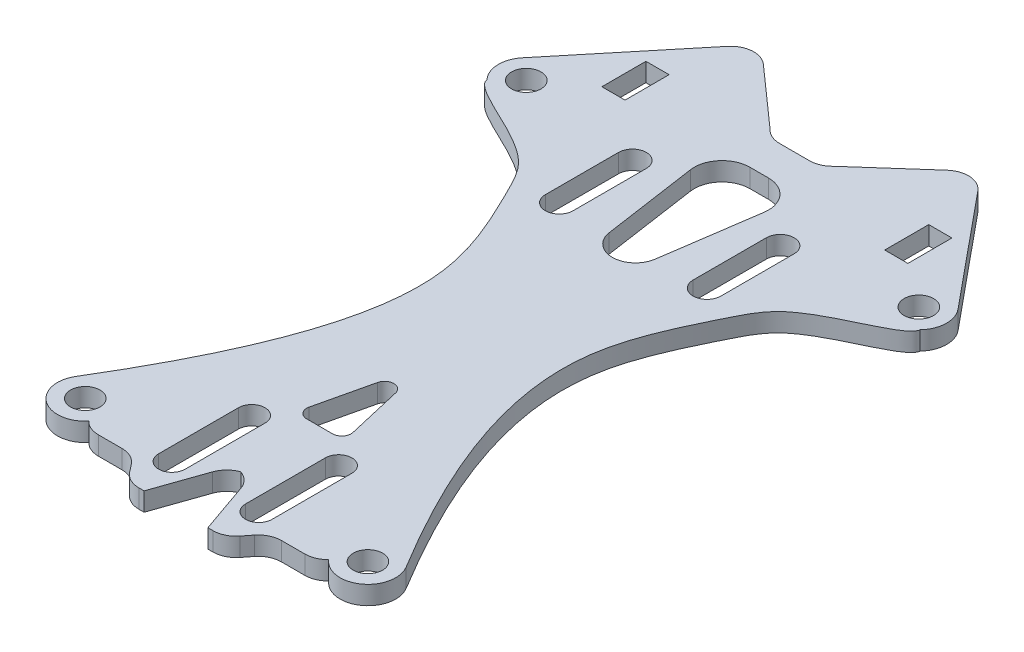
from build123d import *

# Parameters (mm, degrees)
CROQUIS1_R              = 1.5875
CROQUIS1_R_2            = 1.59
CROQUIS1_W              = 2.5
CROQUIS1_H              = 4.75
SALIENTE_EXTRUIR2_DEPTH = 2


with BuildPart() as part:
    # Croquis1 → Saliente-Extruir2 (new body)
    with BuildSketch(Plane(origin=(0, 0, 0), x_dir=(1, 0, 0), z_dir=(0, 1, 0))):
        with BuildLine():
            Line((-13.500997661, 38.247470948), (-23.48270506, 26.126508519))
            ThreePointArc((-23.48270506, 26.126508519), (-24.165408731, 24.125159739), (-23.358354505, 22.170640687))
            add(Edge.make_bspline(
                [(-17.815436951, -27.727159764), (-10.494709665, -15.652410543), (-5.589282311, -1.253212627), (-9.575431127, 8.497808826), (-14.681470714, 18.410285079), (-23.136242341, 20.540450982), (-23.358354505, 22.170640687)],
                knots=[0, 0, 0, 0, 0.481002384, 0.786245044, 0.838144806, 1, 1, 1, 1], degree=3))
            ThreePointArc((-17.815436951, -27.727159764), (-16.972773026, -31.709582726), (-12.935985799, -31.186014181))
            ThreePointArc((-12.935985799, -31.186014181), (-12.114820717, -31.749834132), (-11.138692552, -31.948275137))
            Line((-11.138692552, -31.948275137), (-8.598739942, -31.948275137))
            ThreePointArc((-8.598739942, -31.948275137), (-7.506720993, -32.19938772), (-6.634077803, -32.902279446))
            Line((-6.634077803, -32.902279446), (-5.953226574, -33.767509951))
            ThreePointArc((-5.953226574, -33.767509951), (-5.080583384, -34.470401676), (-3.988564435, -34.721514259))
            Line((-3.988564435, -34.721514259), (-3.441216411, -34.721514259))
            Line((-3.441216411, -34.721514259), (-1.533856825, -29.262119003))
            ThreePointArc((-1.533856825, -29.262119003), (-0.942151005, -28.319542636), (0, -27.727159764))
            ThreePointArc((0, -27.727159764), (0.942151005, -28.319542636), (1.533856825, -29.262119003))
            Line((1.533856825, -29.262119003), (3.441216411, -34.721514259))
            Line((3.441216411, -34.721514259), (3.988564435, -34.721514259))
            ThreePointArc((3.988564435, -34.721514259), (5.080583384, -34.470401676), (5.953226574, -33.767509951))
            Line((5.953226574, -33.767509951), (6.634077803, -32.902279446))
            ThreePointArc((6.634077803, -32.902279446), (7.506720993, -32.19938772), (8.598739942, -31.948275137))
            Line((8.598739942, -31.948275137), (11.138692552, -31.948275137))
            ThreePointArc((11.138692552, -31.948275137), (12.114820717, -31.749834132), (12.935985799, -31.186014181))
            ThreePointArc((12.935985799, -31.186014181), (16.972773026, -31.709582726), (17.815436951, -27.727159764))
            add(Edge.make_bspline(
                [(17.815436951, -27.727159764), (10.494709665, -15.652410543), (5.589282311, -1.253212627), (9.575431127, 8.497808826), (14.681470714, 18.410285079), (23.136242341, 20.540450982), (23.358354505, 22.170640687)],
                knots=[0, 0, 0, 0, 0.481002384, 0.786245044, 0.838144806, 1, 1, 1, 1], degree=3))
            ThreePointArc((23.358354505, 22.170640687), (24.165408731, 24.125159739), (23.48270506, 26.126508519))
            Line((23.48270506, 26.126508519), (13.500997661, 38.247470948))
            ThreePointArc((13.500997661, 38.247470948), (11.765956158, 39.150626323), (9.911661286, 38.528011532))
            Line((9.911661286, 38.528011532), (3.441216411, 32.785293976))
            ThreePointArc((3.441216411, 32.785293976), (2.608431822, 32.194596441), (1.608939272, 31.986105691))
            Line((1.608939272, 31.986105691), (0.563987286, 31.986105691))
            Line((0.563987286, 31.986105691), (-0.563987286, 31.986105691))
            Line((-0.563987286, 31.986105691), (-1.608939272, 31.986105691))
            ThreePointArc((-1.608939272, 31.986105691), (-2.608431822, 32.194596441), (-3.441216411, 32.785293976))
            Line((-3.441216411, 32.785293976), (-9.911661286, 38.528011532))
            ThreePointArc((-9.911661286, 38.528011532), (-11.765956158, 39.150626323), (-13.500997661, 38.247470948))
        make_face()
        with Locations(Location((-15.237860544, -29.262119003, 0), (0, 0, 270))):
            Circle(CROQUIS1_R, mode=Mode.SUBTRACT)
        with BuildLine():
            ThreePointArc((-6.119798022, -21.867659367), (-4.684765235, -20.432626581), (-3.249732449, -21.867659367))
            Line((-3.249732449, -21.867659367), (-3.249732449, -30.47604675))
            ThreePointArc((-3.249732449, -30.47604675), (-4.684765235, -31.911079536), (-6.119798022, -30.47604675))
            Line((-6.119798022, -30.47604675), (-6.119798022, -21.867659367))
        make_face(mode=Mode.SUBTRACT)
        with BuildLine():
            Line((3.249732449, -30.47604675), (3.249732449, -21.867659367))
            ThreePointArc((3.249732449, -21.867659367), (4.684765235, -20.432626581), (6.119798022, -21.867659367))
            Line((6.119798022, -21.867659367), (6.119798022, -30.47604675))
            ThreePointArc((6.119798022, -30.47604675), (4.684765235, -31.911079536), (3.249732449, -30.47604675))
        make_face(mode=Mode.SUBTRACT)
        with Locations(Location((15.237860544, -29.262119003, 0), (0, 0, 270))):
            Circle(CROQUIS1_R, mode=Mode.SUBTRACT)
        with BuildLine():
            Line((-2.367884319, -18.005103727), (-0.974062699, -12.005103727))
            ThreePointArc((-0.974062699, -12.005103727), (0, -11.231382002), (0.974062699, -12.005103727))
            Line((0.974062699, -12.005103727), (2.367884319, -18.005103727))
            ThreePointArc((2.367884319, -18.005103727), (2.176853635, -18.853363403), (1.39382162, -19.231382002))
            Line((1.39382162, -19.231382002), (0.763866627, -19.231382002))
            Line((0.763866627, -19.231382002), (-0.763866627, -19.231382002))
            Line((-0.763866627, -19.231382002), (-1.39382162, -19.231382002))
            ThreePointArc((-1.39382162, -19.231382002), (-2.176853635, -18.853363403), (-2.367884319, -18.005103727))
        make_face(mode=Mode.SUBTRACT)
        with BuildLine():
            ThreePointArc((-9.468375509, 22.47076229), (-7.969046344, 23.970091456), (-6.469717178, 22.47076229))
            Line((-6.469717178, 22.47076229), (-6.469717178, 14.571803083))
            ThreePointArc((-6.469717178, 14.571803083), (-7.969046344, 13.072473917), (-9.468375509, 14.571803083))
            Line((-9.468375509, 14.571803083), (-9.468375509, 22.47076229))
        make_face(mode=Mode.SUBTRACT)
        with BuildLine():
            ThreePointArc((-3.970426322, 24.734392618), (-3.270984433, 27.12952489), (-1.001806653, 28.16717115))
            Line((-1.001806653, 28.16717115), (1.001806653, 28.16717115))
            ThreePointArc((1.001806653, 28.16717115), (3.270984433, 27.12952489), (3.970426322, 24.734392618))
            Line((3.970426322, 24.734392618), (2.473849725, 14.468710767))
            ThreePointArc((2.473849725, 14.468710767), (0, 12.329359543), (-2.473849725, 14.468710767))
            Line((-2.473849725, 14.468710767), (-3.970426322, 24.734392618))
        make_face(mode=Mode.SUBTRACT)
        with Locations(Location((-21.166889821, 24.21941655, 0), (0, 0, 270))):
            Circle(CROQUIS1_R_2, mode=Mode.SUBTRACT)
        with Locations((-15.25, 30.078133807)):
            Rectangle(CROQUIS1_W, CROQUIS1_H, mode=Mode.SUBTRACT)
        with BuildLine():
            Line((6.469717178, 14.571803083), (6.469717178, 22.47076229))
            ThreePointArc((6.469717178, 22.47076229), (7.969046344, 23.970091456), (9.468375509, 22.47076229))
            Line((9.468375509, 22.47076229), (9.468375509, 14.571803083))
            ThreePointArc((9.468375509, 14.571803083), (7.969046344, 13.072473917), (6.469717178, 14.571803083))
        make_face(mode=Mode.SUBTRACT)
        with Locations(Location((21.166889821, 24.21941655, 0), (0, 0, 270))):
            Circle(CROQUIS1_R_2, mode=Mode.SUBTRACT)
        with Locations((15.25, 30.078133807)):
            Rectangle(CROQUIS1_W, CROQUIS1_H, mode=Mode.SUBTRACT)
    extrude(amount=SALIENTE_EXTRUIR2_DEPTH)


solid = part.part
